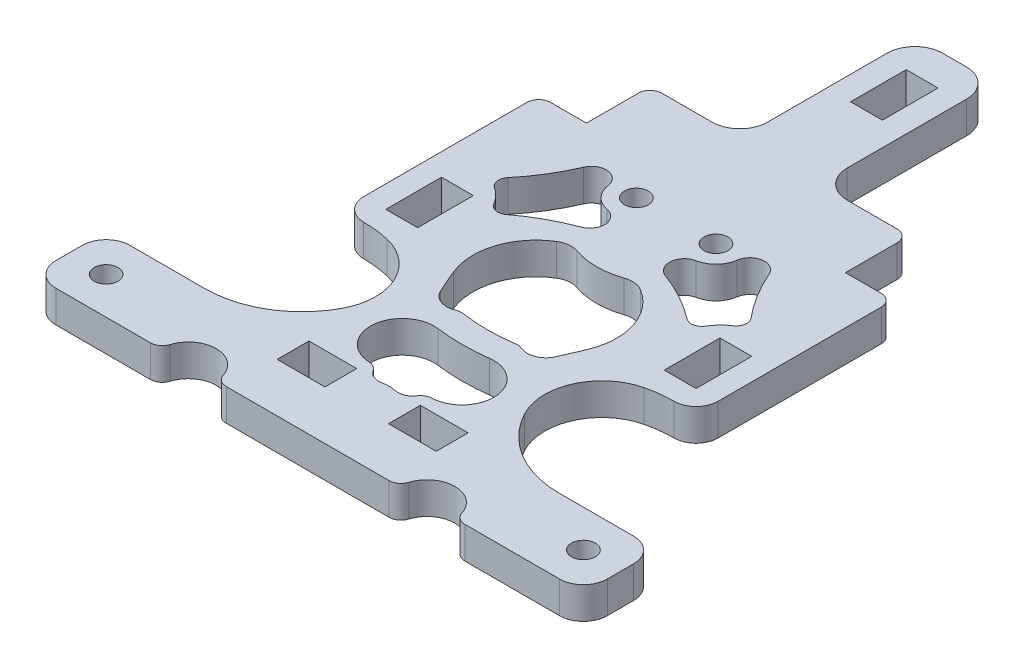
from build123d import *

# Parameters (mm, degrees)
ESQUISSE1_R             = 1.5
ESQUISSE1_W             = 4
ESQUISSE1_H             = 7
ESQUISSE1_W_2           = 6
ESQUISSE1_H_2           = 4
BOSS_EXTRU_1_DEPTH      = 4
ENL_V_MAT_EXTRU_1_REACH = 59.99
ENL_V_MAT_EXTRU_2_REACH = 59.99
ENL_V_MAT_EXTRU_3_REACH = 59.99
CONG_1_R                = 3.5
CONG_2_R                = 3.5
CONG_3_R                = 1.5
ENL_V_MAT_EXTRU_4_REACH = 59.99
CONG_4_R                = 3
CONG_5_R                = 3
ENL_V_MAT_EXTRU_5_REACH = 59.99
ESQUISSE8_R             = 3.5
CONG_6_R                = 1.5


with BuildPart() as part:
    # Esquisse1 → Boss.-Extru.1 (new body)
    with BuildSketch(Plane(origin=(0, 0, 0), x_dir=(1, 0, 0), z_dir=(0, 1, 0))):
        Polygon((-20.28, 5), (-22.28, 5), (-22.28, -37), (-34.66, -37), (-34.66, -46.32), (34.66, -46.32), (34.66, -37), (22.28, -37), (22.28, 5), (20.28, 5), (16.28, 5), (16.28, 13), (5, 13), (5, 35), (-5, 35), (-5, 13), (-16.28, 13), (-16.28, 5), align=None)
        with Locations(Location((-5, 0, 0), (0, 0, 270))):
            Circle(ESQUISSE1_R, mode=Mode.SUBTRACT)
        with Locations(Location((5, 0, 0), (0, 0, 90))):
            Circle(ESQUISSE1_R, mode=Mode.SUBTRACT)
        with Locations(Location((-30, -41.66, 0), (0, 0, 270))):
            Circle(ESQUISSE1_R, mode=Mode.SUBTRACT)
        with Locations(Location((30, -41.66, 0), (0, 0, 90))):
            Circle(ESQUISSE1_R, mode=Mode.SUBTRACT)
        with Locations((0, 27.42)):
            Rectangle(ESQUISSE1_W, ESQUISSE1_H, mode=Mode.SUBTRACT)
        with Locations((-17.5, -13.5)):
            Rectangle(ESQUISSE1_W, ESQUISSE1_H, mode=Mode.SUBTRACT)
        with Locations((-7, -38.16)):
            Rectangle(ESQUISSE1_W_2, ESQUISSE1_H_2, mode=Mode.SUBTRACT)
        with Locations((7, -38.16)):
            Rectangle(ESQUISSE1_W_2, ESQUISSE1_H_2, mode=Mode.SUBTRACT)
        with Locations((17.5, -13.5)):
            Rectangle(ESQUISSE1_W, ESQUISSE1_H, mode=Mode.SUBTRACT)
    extrude(amount=BOSS_EXTRU_1_DEPTH)

    # Esquisse2 → Enlèv. mat.-Extru.1 (cut, up to next)
    with BuildSketch(Plane(origin=(0, 4, 0), x_dir=(1, 0, 0), z_dir=(0, 1, 0)), mode=Mode.PRIVATE) as enl_v_mat_extru_1_sk1:
        with BuildLine():
            ThreePointArc((-14.9974668, -7.843519448), (-14.058937243, -8.627559279), (-13.321584394, -9.603195975))
            ThreePointArc((-13.321584394, -9.603195975), (-12.428040198, -10.235555734), (-11.361521034, -9.988904221))
            ThreePointArc((-11.361521034, -9.988904221), (-8.447920047, -8.097394436), (-5.290042477, -6.650090308))
            ThreePointArc((-5.290042477, -6.650090308), (-4.088898303, -4.755535803), (-5.589901119, -3.088480121))
            ThreePointArc((-5.589901119, -3.088480121), (-7.276914991, -2.168490468), (-8.113566287, -0.438631695))
            ThreePointArc((-8.113566287, -0.438631695), (-9.70546362, 1.141857781), (-11.656322949, 0.034504187))
            ThreePointArc((-11.656322949, 0.034504187), (-13.25585737, -3.049060247), (-15.287160414, -5.866982872))
            ThreePointArc((-15.287160414, -5.866982872), (-15.585513038, -6.920209252), (-14.9974668, -7.843519448))
        make_face()
    enl_v_mat_extru_1_tool1 = extrude(enl_v_mat_extru_1_sk1.sketch, amount=-ENL_V_MAT_EXTRU_1_REACH, mode=Mode.PRIVATE) & part.part
    # Esquisse2 → Enlèv. mat.-Extru.1 (cut, up to next)
    with BuildSketch(Plane(origin=(0, 4, 0), x_dir=(1, 0, 0), z_dir=(0, 1, 0)), mode=Mode.PRIVATE) as enl_v_mat_extru_1_sk2:
        with BuildLine():
            ThreePointArc((5.589901119, -3.088480121), (4.088898303, -4.755535803), (5.290042477, -6.650090308))
            ThreePointArc((5.290042477, -6.650090308), (8.447920047, -8.097394436), (11.361521034, -9.988904221))
            ThreePointArc((11.361521034, -9.988904221), (12.428040198, -10.235555734), (13.321584394, -9.603195975))
            ThreePointArc((13.321584394, -9.603195975), (14.058937243, -8.627559279), (14.9974668, -7.843519448))
            ThreePointArc((14.9974668, -7.843519448), (15.585513038, -6.920209252), (15.287160414, -5.866982872))
            ThreePointArc((15.287160414, -5.866982872), (13.25585737, -3.049060247), (11.656322949, 0.034504187))
            ThreePointArc((11.656322949, 0.034504187), (9.70546362, 1.141857781), (8.113566287, -0.438631695))
            ThreePointArc((8.113566287, -0.438631695), (7.276914991, -2.168490468), (5.589901119, -3.088480121))
        make_face()
    enl_v_mat_extru_1_tool2 = extrude(enl_v_mat_extru_1_sk2.sketch, amount=-ENL_V_MAT_EXTRU_1_REACH, mode=Mode.PRIVATE) & part.part
    add(enl_v_mat_extru_1_tool1.solids().sort_by_distance((-10.104676, 4, 4.861596))[0], mode=Mode.SUBTRACT)
    add(enl_v_mat_extru_1_tool2.solids().sort_by_distance((10.104676, 4, 4.861596))[0], mode=Mode.SUBTRACT)

    # Esquisse3 → Enlèv. mat.-Extru.2 (cut, up to next)
    with BuildSketch(Plane(origin=(0, 4, 0), x_dir=(1, 0, 0), z_dir=(0, 1, 0)), mode=Mode.PRIVATE) as enl_v_mat_extru_2_sk1:
        with BuildLine():
            ThreePointArc((-3.934570919, -34.661427668), (-3.25, -34.860961894), (-2.734912831, -35.354050587))
            ThreePointArc((-2.734912831, -35.354050587), (-1.93927123, -36.028172694), (-0.901821799, -36.133931151))
            ThreePointArc((-0.901821799, -36.133931151), (0, -36.043871504), (0.901821799, -36.133931151))
            ThreePointArc((0.901821799, -36.133931151), (1.93927123, -36.028172694), (2.734912831, -35.354050587))
            ThreePointArc((2.734912831, -35.354050587), (3.25, -34.860961894), (3.934570919, -34.661427668))
            ThreePointArc((3.934570919, -34.661427668), (7.745022524, -30.318334752), (3.241418184, -26.699005331))
            ThreePointArc((3.241418184, -26.699005331), (0, -26.910051622), (-3.241418184, -26.699005331))
            ThreePointArc((-3.241418184, -26.699005331), (-7.745022524, -30.318334752), (-3.934570919, -34.661427668))
        make_face()
    enl_v_mat_extru_2_tool1 = extrude(enl_v_mat_extru_2_sk1.sketch, amount=-ENL_V_MAT_EXTRU_2_REACH, mode=Mode.PRIVATE) & part.part
    add(enl_v_mat_extru_2_tool1.solids().sort_by_distance((0, 4, 31.014631))[0], mode=Mode.SUBTRACT)

    # Esquisse4 → Enlèv. mat.-Extru.3 (cut, up to next)
    with BuildSketch(Plane(origin=(0, 4, 0), x_dir=(1, 0, 0), z_dir=(0, 1, 0)), mode=Mode.PRIVATE) as enl_v_mat_extru_3_sk1:
        with BuildLine():
            ThreePointArc((-3.204236741, -23.492683837), (0, -23.72926901), (3.204236741, -23.492683837))
            ThreePointArc((3.204236741, -23.492683837), (3.729211384, -23.484474006), (4.238200501, -23.613298912))
            ThreePointArc((4.238200501, -23.613298912), (5.947114761, -23.612368685), (7.184676805, -22.433882792))
            ThreePointArc((7.184676805, -22.433882792), (7.833923694, -20.976940348), (8.452629907, -19.506768443))
            ThreePointArc((8.452629907, -19.506768443), (8.650133896, -14.04633429), (5.268411363, -9.754562897))
            ThreePointArc((5.268411363, -9.754562897), (4.141434744, -9.367776338), (2.957336552, -9.500409716))
            ThreePointArc((2.957336552, -9.500409716), (0, -9.996838884), (-2.957336552, -9.500409716))
            ThreePointArc((-2.957336552, -9.500409716), (-4.141434744, -9.367776338), (-5.268411363, -9.754562897))
            ThreePointArc((-5.268411363, -9.754562897), (-8.650133896, -14.04633429), (-8.452629907, -19.506768443))
            ThreePointArc((-8.452629907, -19.506768443), (-7.833923694, -20.976940348), (-7.184676805, -22.433882792))
            ThreePointArc((-7.184676805, -22.433882792), (-5.947114761, -23.612368685), (-4.238200501, -23.613298912))
            ThreePointArc((-4.238200501, -23.613298912), (-3.729211384, -23.484474006), (-3.204236741, -23.492683837))
        make_face()
    enl_v_mat_extru_3_tool1 = extrude(enl_v_mat_extru_3_sk1.sketch, amount=-ENL_V_MAT_EXTRU_3_REACH, mode=Mode.PRIVATE) & part.part
    add(enl_v_mat_extru_3_tool1.solids().sort_by_distance((0, 4, 16.711487))[0], mode=Mode.SUBTRACT)

    # Congé1
    cong_1_edges = [part.edges().sort_by_distance(p)[0] for p in [
        (-5, 2, -35),
        (5, 2, -35),
    ]]
    fillet(cong_1_edges, radius=CONG_1_R)

    # Congé2
    cong_2_edges = [part.edges().sort_by_distance(p)[0] for p in [
        (-5, 2, -13),
        (5, 2, -13),
    ]]
    fillet(cong_2_edges, radius=CONG_2_R)

    # Congé3
    cong_3_edges = [part.edges().sort_by_distance(p)[0] for p in [
        (22.28, 2, -5),
        (-22.28, 2, -5),
        (-16.28, 2, -13),
        (16.28, 2, -13),
    ]]
    fillet(cong_3_edges, radius=CONG_3_R)

    # Esquisse7 → Enlèv. mat.-Extru.4 (cut, up to next)
    with BuildSketch(Plane(origin=(0, 4, 0), x_dir=(1, 0, 0), z_dir=(0, 1, 0)), mode=Mode.PRIVATE) as enl_v_mat_extru_4_sk1:
        with BuildLine():
            Line((-22.28, -17), (-22.28, -37))
            ThreePointArc((-22.28, -37), (-16.000012961, -35.267986448), (-11.495708343, -30.561677059))
            ThreePointArc((-11.495708343, -30.561677059), (-11.263143502, -24.222708134), (-16.146891575, -20.174792843))
            ThreePointArc((-16.146891575, -20.174792843), (-17.81186512, -19.879037913), (-19.5, -19.78))
            ThreePointArc((-19.5, -19.78), (-21.465756852, -18.965756852), (-22.28, -17))
        make_face()
    enl_v_mat_extru_4_tool1 = extrude(enl_v_mat_extru_4_sk1.sketch, amount=-ENL_V_MAT_EXTRU_4_REACH, mode=Mode.PRIVATE) & part.part
    enl_v_mat_extru_4 = enl_v_mat_extru_4_tool1.solids().sort_by_distance((-17.328715, 4, 27.806477))[0]
    add(enl_v_mat_extru_4, mode=Mode.SUBTRACT)

    # Symétrie1: Enlèv. mat.-Extru.4 across plane
    add(enl_v_mat_extru_4.mirror(Plane(origin=(0, 0, 0), x_dir=(0, 0, 1), z_dir=(1, 0, 0))), mode=Mode.SUBTRACT)

    # Congé4
    cong_4_edges = [part.edges().sort_by_distance(p)[0] for p in [
        (-34.66, 2, 46.32),
        (-34.66, 2, 37),
    ]]
    fillet(cong_4_edges, radius=CONG_4_R)

    # Congé5
    cong_5_edges = [part.edges().sort_by_distance(p)[0] for p in [
        (34.66, 2, 37),
        (34.66, 2, 46.32),
    ]]
    fillet(cong_5_edges, radius=CONG_5_R)

    # Esquisse8 → Enlèv. mat.-Extru.5 (cut, up to next)
    with BuildSketch(Plane(origin=(0, 4, 0), x_dir=(1, 0, 0), z_dir=(0, 1, 0)), mode=Mode.PRIVATE) as enl_v_mat_extru_5_sk1:
        with Locations((-15, -46.32)):
            Circle(ESQUISSE8_R)
    enl_v_mat_extru_5_tool1 = extrude(enl_v_mat_extru_5_sk1.sketch, amount=-ENL_V_MAT_EXTRU_5_REACH, mode=Mode.PRIVATE) & part.part
    # Esquisse8 → Enlèv. mat.-Extru.5 (cut, up to next)
    with BuildSketch(Plane(origin=(0, 4, 0), x_dir=(1, 0, 0), z_dir=(0, 1, 0)), mode=Mode.PRIVATE) as enl_v_mat_extru_5_sk2:
        with Locations((15, -46.32)):
            Circle(ESQUISSE8_R)
    enl_v_mat_extru_5_tool2 = extrude(enl_v_mat_extru_5_sk2.sketch, amount=-ENL_V_MAT_EXTRU_5_REACH, mode=Mode.PRIVATE) & part.part
    add(enl_v_mat_extru_5_tool1.solids().sort_by_distance((-15, 4, 46.32))[0], mode=Mode.SUBTRACT)
    add(enl_v_mat_extru_5_tool2.solids().sort_by_distance((15, 4, 46.32))[0], mode=Mode.SUBTRACT)

    # Congé6
    cong_6_edges = [part.edges().sort_by_distance(p)[0] for p in [
        (-18.5, 2, 46.32),
        (-11.5, 2, 46.32),
        (11.5, 2, 46.32),
        (18.5, 2, 46.32),
    ]]
    fillet(cong_6_edges, radius=CONG_6_R)


solid = part.part
